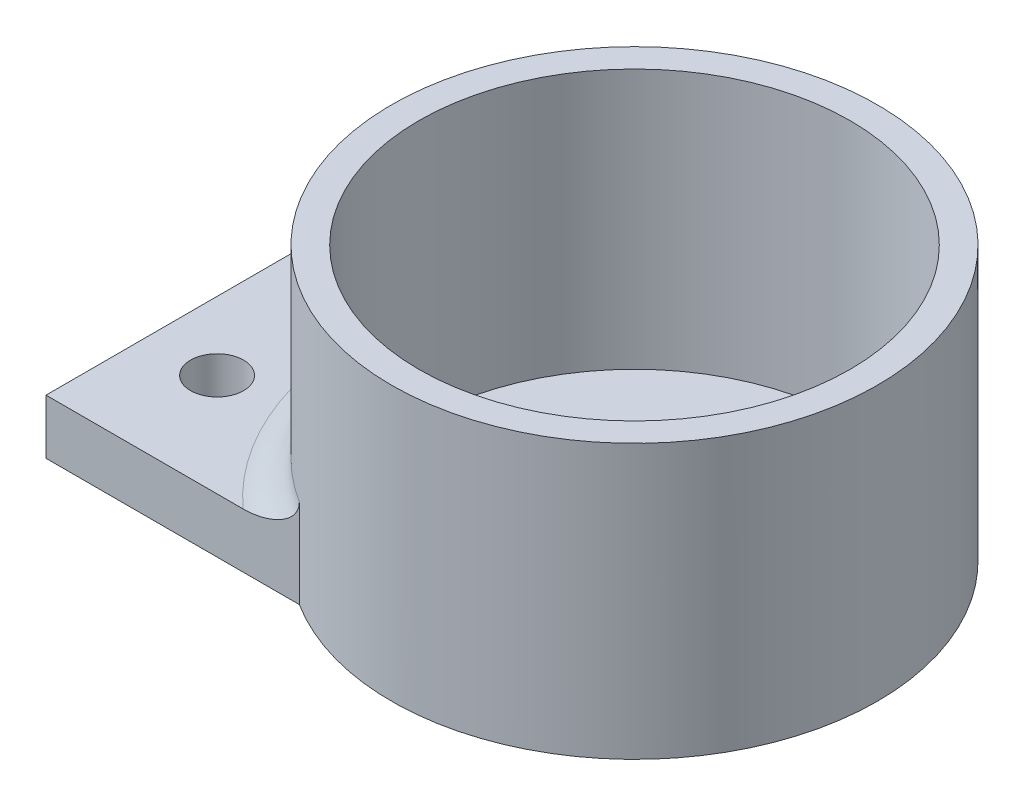
from build123d import *

# Parameters (mm, degrees)
SKETCH1_R           = 14.2
SKETCH1_R_2         = 12.6
BOSS_EXTRUDE1_DEPTH = 16
BOSS_EXTRUDE2_DEPTH = 3.2
SKETCH3_R           = 1.55
CUT_EXTRUDE1_DEPTH  = 10
FILLET1_R           = 2
SKETCH4_R           = 12.6
SKETCH4_R_2         = 3.8
BOSS_EXTRUDE3_DEPTH = 0.8


with BuildPart() as part:
    # Sketch1 → Boss-Extrude1 (new body)
    with BuildSketch(Plane(origin=(0, 0, 0), x_dir=(1, 0, 0), z_dir=(0, 1, 0))):
        with Locations(Location((0, 0, 0), (0, 0, 270))):
            Circle(SKETCH1_R)
        with Locations(Location((0, 0, 0), (0, 0, 270))):
            Circle(SKETCH1_R_2, mode=Mode.SUBTRACT)
    extrude(amount=BOSS_EXTRUDE1_DEPTH)

    # Sketch2 → Boss-Extrude2 (add)
    with BuildSketch(Plane(origin=(0, 0, 0), x_dir=(-1, 0, 0), z_dir=(0, -1, 0))):
        with BuildLine():
            Line((7.592101158, -12), (22.4, -12))
            Line((22.4, -12), (22.4, 12))
            Line((22.4, 12), (7.592101158, 12))
            ThreePointArc((7.592101158, 12), (12.438806945, 6.8495315), (14.2, 0))
            ThreePointArc((14.2, 0), (12.438806945, -6.8495315), (7.592101158, -12))
        make_face()
    extrude(amount=-BOSS_EXTRUDE2_DEPTH)

    # Sketch3 → Cut-Extrude1 (cut)
    with BuildSketch(Plane(origin=(0, 0, 0), x_dir=(-1, 0, 0), z_dir=(0, -1, 0))):
        with Locations(Location((18.4, 6, 0), (0, 0, 90))):
            Circle(SKETCH3_R)
        with Locations(Location((18.4, -6, 0), (0, 0, 90))):
            Circle(SKETCH3_R)
    extrude(amount=-CUT_EXTRUDE1_DEPTH, mode=Mode.SUBTRACT)

    # Fillet1
    fillet1_edges = [part.edges().sort_by_distance(p)[0] for p in [
        (-14.2, 3.2, 0),
    ]]
    fillet(fillet1_edges, radius=FILLET1_R)

    # Sketch4 → Boss-Extrude3 (add)
    with BuildSketch(Plane(origin=(0, 0, 0), x_dir=(-1, 0, 0), z_dir=(0, -1, 0))):
        with Locations(Location((0, 0, 0), (0, 0, 90))):
            Circle(SKETCH4_R)
        with Locations(Location((0, 0, 0), (0, 0, 90))):
            Circle(SKETCH4_R_2, mode=Mode.SUBTRACT)
    extrude(amount=-BOSS_EXTRUDE3_DEPTH)


solid = part.part
